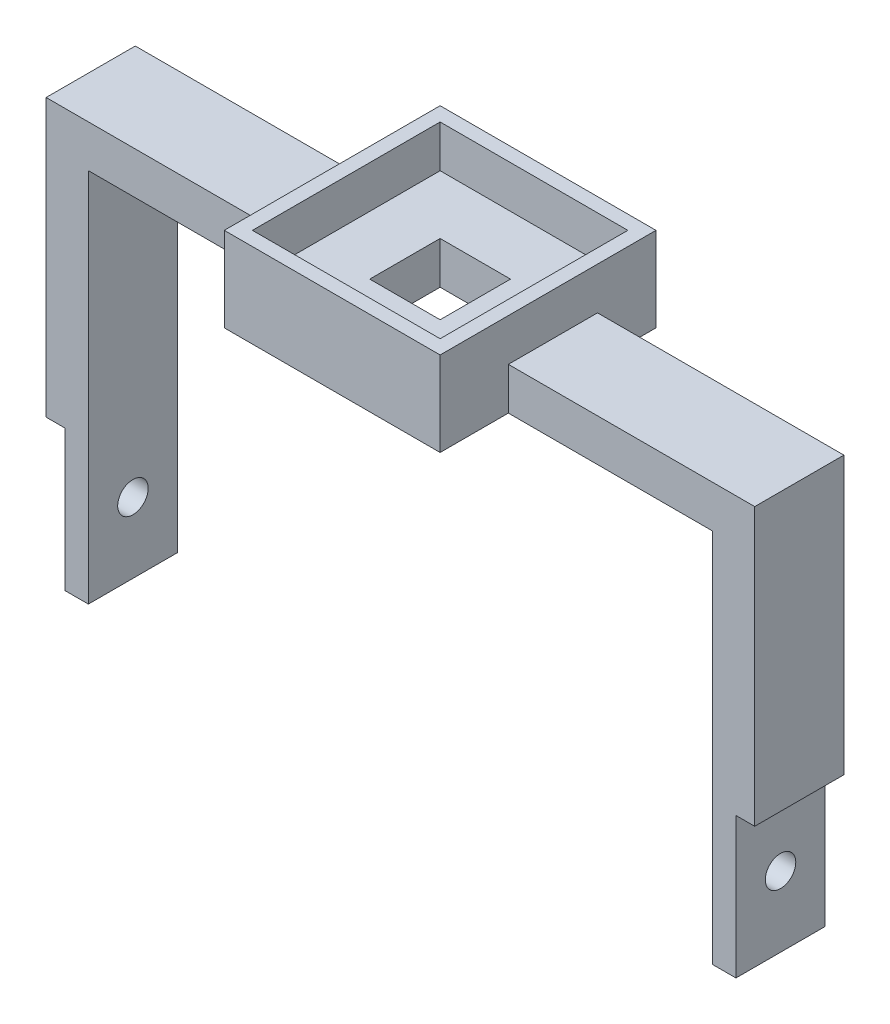
from build123d import *

# Parameters (mm, degrees)
Y_KSEKLIK_EKSTR_ZYON1_DEPTH             = 19
IZIM2_W                                 = 40
IZIM2_H                                 = 40
Y_KSEKLIK_EKSTR_ZYON2_DEPTH             = 9
IZIM5_W                                 = 46
IZIM5_H                                 = 46
IZIM5_W_2                               = 40
IZIM5_H_2                               = 40
Y_KSEKLIK_EKSTR_ZYON3_DEPTH             = 9
Y_KSEKLIK_EKSTR_ZYON3_DIRECTION_2_REACH = 172.345
KES_EKSTR_ZYON1_DEPTH                   = 9
KES_EKSTR_ZYON1_DEPTH_BACK              = 9
IZIM7_W                                 = 15
IZIM7_H                                 = 15
IZIM8_R                                 = 3.25
KES_EKSTR_ZYON2_DEPTH                   = 163


with BuildPart() as part:
    # Çizim1 → Yükseklik-Ekstrüzyon1 (new body)
    with BuildSketch(Plane.XY):
        Polygon((0, 0), (0, 80), (133, 80), (133, 0), (138, 0), (138, 30), (142, 30), (142, 89), (-9, 89), (-9, 30), (-5, 30), (-5, 0), align=None)
    extrude(amount=Y_KSEKLIK_EKSTR_ZYON1_DEPTH)

    # Çizim2 → Yükseklik-Ekstrüzyon2 (add)
    with BuildSketch(Plane(origin=(0, 89, 0), x_dir=(1, 0, 0), z_dir=(0, 1, 0))):
        with Locations((66.5, -10.538159249)):
            Rectangle(IZIM2_W, IZIM2_H)
    extrude(amount=-Y_KSEKLIK_EKSTR_ZYON2_DEPTH)

    # Çizim5 → Yükseklik-Ekstrüzyon3 (add)
    with BuildSketch(Plane(origin=(0, 89, 0), x_dir=(1, 0, 0), z_dir=(0, 1, 0))):
        with Locations((66.5, -10.538159249)):
            Rectangle(IZIM5_W, IZIM5_H)
        with Locations((66.5, -10.538159249)):
            Rectangle(IZIM5_W_2, IZIM5_H_2, mode=Mode.SUBTRACT)
    extrude(amount=Y_KSEKLIK_EKSTR_ZYON3_DEPTH)

    # Yükseklik-Ekstrüzyon3 direction 2: up to this face of the body (flat: up to its plane)
    y_kseklik_ekstr_zyon3_direction_2_end = Plane(part.part.faces().sort_by_distance((66.5, 80, 9.993333768))[0])
    # Çizim5 → Yükseklik-Ekstrüzyon3 direction 2 (add, up to the picked face)
    with BuildSketch(Plane(origin=(0, 89, 0), x_dir=(1, 0, 0), z_dir=(0, 1, 0)), mode=Mode.PRIVATE) as y_kseklik_ekstr_zyon3_direction_2_sk1:
        with Locations((66.5, -10.538159249)):
            Rectangle(IZIM5_W, IZIM5_H)
        with Locations((66.5, -10.538159249)):
            Rectangle(IZIM5_W_2, IZIM5_H_2, mode=Mode.SUBTRACT)
    y_kseklik_ekstr_zyon3_direction_2_tool1 = split(extrude(y_kseklik_ekstr_zyon3_direction_2_sk1.sketch, amount=-Y_KSEKLIK_EKSTR_ZYON3_DIRECTION_2_REACH, mode=Mode.PRIVATE), bisect_by=y_kseklik_ekstr_zyon3_direction_2_end, keep=Keep.BOTH, mode=Mode.PRIVATE)
    add(y_kseklik_ekstr_zyon3_direction_2_tool1.solids().sort_by(Axis((66.5, 89, 32.887621), (0, -1, 0)))[0])

    # Çizim7 → Kes-Ekstrüzyon1 (cut, two sides: drawn at the far end of the back side and taken through both)
    with BuildSketch(Plane(origin=(0, 89, 0), x_dir=(1, 0, 0), z_dir=(0, 1, 0)).offset(-KES_EKSTR_ZYON1_DEPTH_BACK)):
        with Locations((66.5, -10.538159249)):
            Rectangle(IZIM7_W, IZIM7_H)
    extrude(amount=KES_EKSTR_ZYON1_DEPTH + KES_EKSTR_ZYON1_DEPTH_BACK, mode=Mode.SUBTRACT)

    # Çizim8 → Kes-Ekstrüzyon2 (cut)
    with BuildSketch(Plane(origin=(138, 0, 0), x_dir=(0, 0, -1), z_dir=(1, 0, 0))):
        with Locations((-9.5, 15)):
            Circle(IZIM8_R)
    extrude(amount=-KES_EKSTR_ZYON2_DEPTH, mode=Mode.SUBTRACT)


solid = part.part
